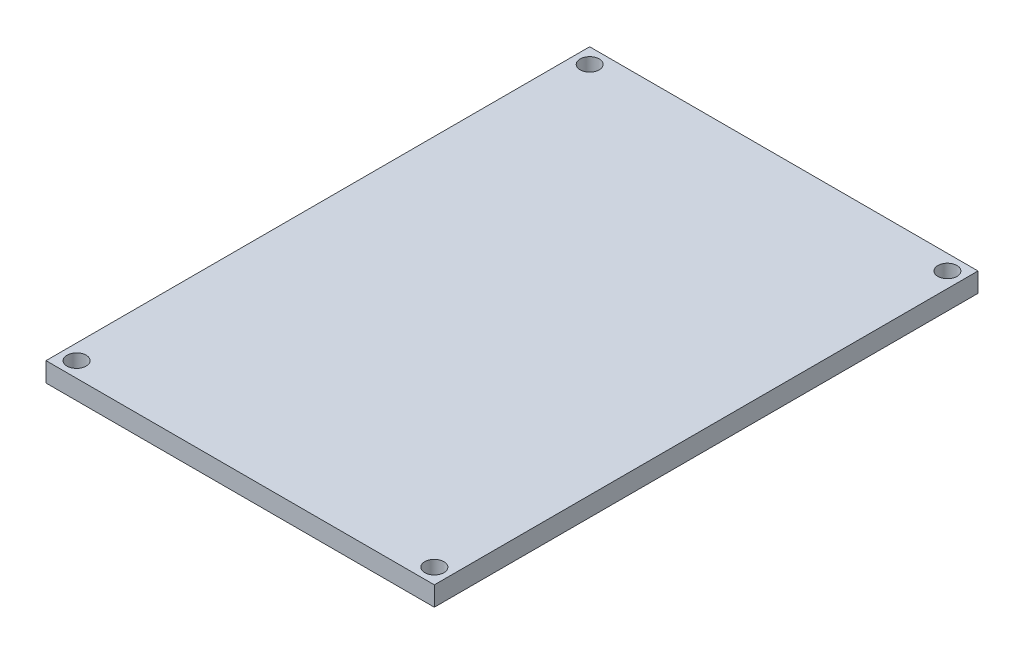
from build123d import *

# Parameters (mm, degrees)
SKETCH1_W           = 50.8
SKETCH1_H           = 71.12
BOSS_EXTRUDE1_DEPTH = 2.54
SKETCH2_R           = 1.245581387
SKETCH2_R_2         = 1.246523933
SKETCH2_R_3         = 1.248703554
SKETCH2_R_4         = 1.251934436
CUT_EXTRUDE1_DEPTH  = 63.156840816


with BuildPart() as part:
    # Sketch1 → Boss-Extrude1 (new body)
    with BuildSketch(Plane(origin=(0, 0, 0), x_dir=(1, 0, 0), z_dir=(0, 1, 0))):
        with Locations((-18.357859546, -8.511203616)):
            Rectangle(SKETCH1_W, SKETCH1_H)
    extrude(amount=BOSS_EXTRUDE1_DEPTH)

    # Sketch2 → Cut-Extrude1 (cut, through all)
    with BuildSketch(Plane(origin=(0, 2.54, 0), x_dir=(1, 0, 0), z_dir=(0, 1, 0))):
        with Locations(Location((-41.757859546, 25.048796384, 0), (0, 0, 270))):
            Circle(SKETCH2_R)
        with Locations(Location((5.042140454, 25.048796384, 0), (0, 0, 270))):
            Circle(SKETCH2_R_2)
        with Locations(Location((-41.757859546, -42.071203616, 0), (0, 0, 270))):
            Circle(SKETCH2_R_3)
        with Locations(Location((5.042140454, -42.071203616, 0), (0, 0, 270))):
            Circle(SKETCH2_R_4)
    extrude(amount=-CUT_EXTRUDE1_DEPTH, mode=Mode.SUBTRACT)


solid = part.part
